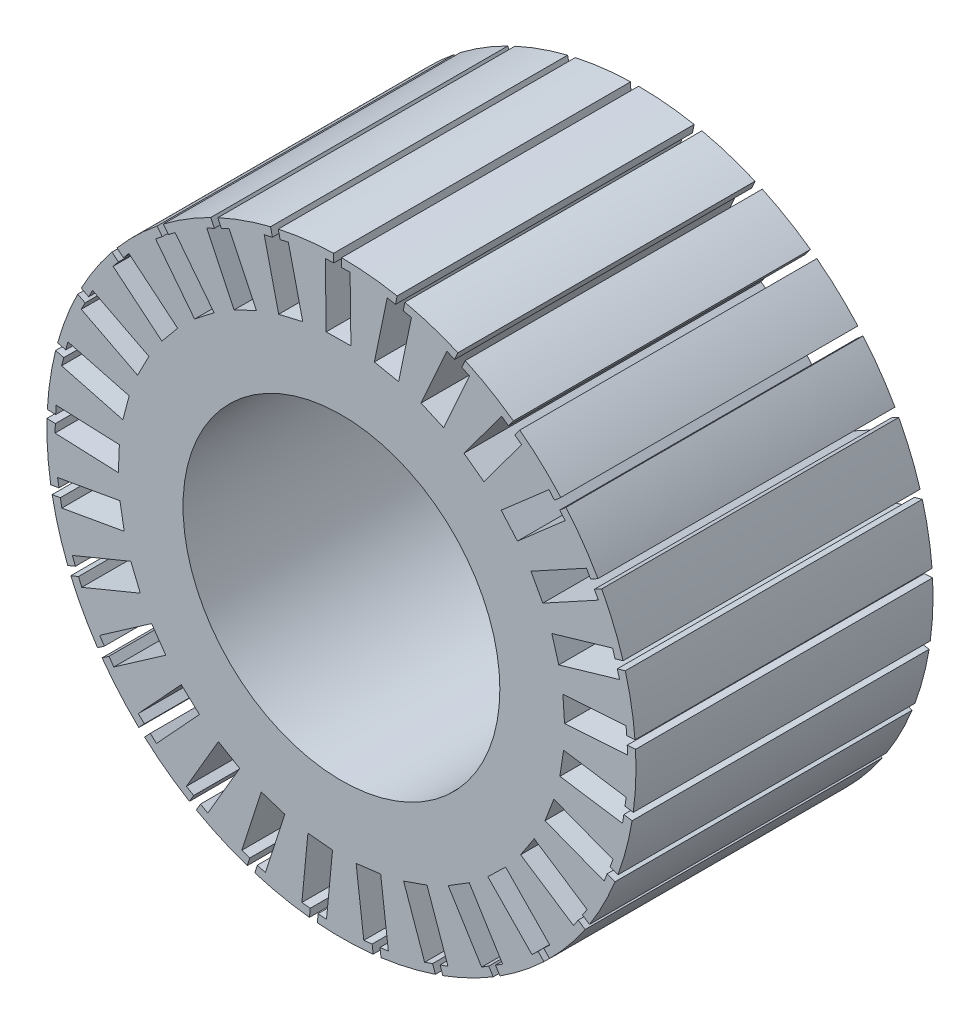
from build123d import *

# Parameters (mm, degrees)
ROTOR_STACK_START = -15
SKETCH_1_R        = 29.75
SKETCH_1_R_2      = 16
ROTOR_STACK_DEPTH = 30
ROTOR_SLOTS_DEPTH = 16


with BuildPart() as part:
    # Эскиз1 → Rotor_stack (new body)
    with BuildSketch(Plane.XY.offset(ROTOR_STACK_START)):
        Circle(SKETCH_1_R)
        Circle(SKETCH_1_R_2, mode=Mode.SUBTRACT)
    extrude(amount=ROTOR_STACK_DEPTH)

    # Эскиз2 → Rotor_slots (cut, symmetric)
    with BuildSketch(Plane.XY):
        Polygon((30.70491713, 1.664501137), (28.861684244, 1.540513747), (28.918731651, 0.692430264), (22.533161901, 0.262896843), (22.365375408, 2.757260027), (28.750945159, 3.186793448), (28.807992566, 2.338709965), (30.651225452, 2.462697356), align=None)
        Polygon((29.629234689, 8.226235577), (27.855749187, 7.708906358), (28.093775737, 6.892914103), (21.949834048, 5.100714194), (21.249755958, 7.500691416), (27.393697648, 9.292891325), (27.631724198, 8.47689907), (29.4052097, 8.994228289), align=None)
        Polygon((27.168122163, 14.403320385), (25.547310257, 13.516839077), (25.955186093, 12.771092939), (20.34015635, 9.700027818), (19.140521537, 11.893398812), (24.755551281, 14.964463933), (25.163427117, 14.218717795), (26.784239023, 15.105199103), align=None)
        Polygon((23.436658441, 19.90692194), (22.044307494, 18.692739423), (22.602960795, 18.052109663), (17.779395547, 13.845778923), (16.136297602, 15.729984098), (20.959862849, 19.936314838), (21.518516151, 19.295685079), (22.910867099, 20.509867596), align=None)
        Polygon((18.609322618, 24.479697949), (17.510537412, 22.994588049), (18.193846171, 22.489029803), (14.387289969, 17.344116793), (12.377558325, 18.83105281), (16.184114527, 23.97596582), (16.867423286, 23.470407574), (17.966208492, 24.955517475), align=None)
        Polygon((12.911835552, 27.90783049), (12.157994063, 26.221235294), (12.934007522, 25.874387904), (10.322450703, 20.031463039), (8.040058177, 21.051602421), (10.651614996, 26.894527287), (11.427628455, 26.547679897), (12.181469944, 28.234275092), align=None)
        Polygon((6.610605407, 30.031023895), (6.236956424, 28.22180672), (7.069389055, 28.049888385), (5.774945114, 21.782160337), (3.326613846, 22.287802501), (4.621057787, 28.555530549), (5.453490418, 28.383612213), (5.827139401, 30.192829387), align=None)
        Polygon((0.000270699, 30.749999999), (0.024285634, 28.90275783), (0.874213814, 28.913807259), (0.95740951, 22.514348026), (-1.542379252, 22.481849707), (-1.625574949, 28.88130894), (-0.77564677, 28.892358368), (-0.799661705, 30.739600537), align=None)
        Polygon((-6.610076666, 30.031140279), (-6.189520724, 28.232248107), (-5.361838694, 28.425748641), (-3.904893498, 22.193789824), (-6.339252411, 21.624670607), (-7.796197607, 27.856629424), (-6.968515576, 28.050129958), (-7.389071518, 29.84902213), align=None)
        Polygon((-12.911344193, 27.908057817), (-12.113911973, 26.241629841), (-11.347177584, 26.60853361), (-8.584608027, 20.835474677), (-10.839709172, 19.756345944), (-13.602278729, 25.529404877), (-12.83554434, 25.896308646), (-13.632976559, 27.562736623), align=None)
        Polygon((-18.608891615, 24.48002559), (-17.471870162, 23.023982128), (-16.801935061, 23.547133121), (-12.862915825, 18.502915891), (-14.83331318, 16.964236502), (-18.772332416, 22.008453732), (-18.102397316, 22.531604724), (-19.239418768, 23.987648185), align=None)
        Polygon((-23.436307947, 19.907334573), (-22.01286312, 18.729758601), (-21.471052729, 19.384694857), (-16.539767975, 15.305181323), (-18.13332795, 13.378898216), (-23.064612703, 17.45841175), (-22.522802312, 18.113348007), (-23.946247139, 19.290923979), align=None)
        Polygon((-27.167868568, 14.403798717), (-25.524559065, 13.559752378), (-25.136207835, 14.315849807), (-19.443238958, 11.391793486), (-20.585448458, 9.167977519), (-26.278417335, 12.092033839), (-25.890066105, 12.848131268), (-27.533375608, 13.692177607), align=None)
        Polygon((-29.629089849, 8.226757242), (-27.842754996, 7.755707204), (-27.626021799, 8.57761153), (-21.437565696, 6.945738047), (-22.075016276, 4.528372382), (-28.263472378, 6.160245865), (-28.046739181, 6.982150191), (-29.833074035, 7.453200229), align=None)
        Polygon((-30.704887819, 1.665041741), (-28.859054648, 1.589013781), (-28.824073688, 2.438293672), (-22.429495689, 2.174907617), (-22.532380867, -0.322974414), (-28.926958866, -0.059588359), (-28.891977905, 0.789691532), (-30.737811076, 0.865719491), align=None)
        Polygon((-30.344959361, -4.974529261), (-28.52593698, -4.65198016), (-28.674343927, -3.815036088), (-22.372647392, -2.697619077), (-21.936156372, -5.159219286), (-28.237852907, -6.276636298), (-28.386259854, -5.439692226), (-30.205282235, -5.762241328), align=None)
        Polygon((-28.566134329, -11.381496803), (-26.858978203, -10.675452679), (-27.183833713, -9.889979002), (-21.269678968, -7.4440081), (-20.314221585, -9.754224798), (-26.22837633, -12.200195699), (-26.55323184, -11.414722022), (-28.260387967, -12.120766146), align=None)
        Polygon((-25.451588605, -17.256278205), (-23.936123457, -16.199752895), (-24.422237648, -15.502477488), (-19.172163995, -11.842323579), (-17.742416374, -13.893133599), (-22.992490027, -17.553287509), (-23.478604218, -16.856012102), (-24.994069366, -17.912537411), align=None)
        Polygon((-21.146954885, -22.324175216), (-19.89404218, -20.966570671), (-20.518684893, -20.390097358), (-16.178179942, -15.686905168), (-14.340995493, -17.382414915), (-18.681500444, -22.085607104), (-19.306143157, -21.50913379), (-20.559055862, -22.866738335), align=None)
        Polygon((-15.853513058, -26.348218606), (-14.921737603, -24.753014906), (-15.655701238, -24.324298936), (-12.427722176, -18.797984507), (-10.269005602, -20.058913828), (-13.496984664, -25.585228257), (-14.230948299, -25.156512288), (-15.162723754, -26.751715989), align=None)
        Polygon((-9.81877858, -29.140248578), (-9.251709159, -27.382035674), (-10.060674393, -27.121123332), (-8.096157933, -21.030090982), (-5.716848422, -21.797480224), (-7.681364881, -27.888512573), (-8.490330115, -27.627600231), (-9.057399537, -29.385813136), align=None)
        Polygon((-3.324928929, -30.569712914), (-3.149081077, -28.730702887), (-3.995221595, -28.649794143), (-3.386026344, -22.278853777), (-0.897377763, -22.516820671), (-1.506573014, -28.887761037), (-2.352713532, -28.806852293), (-2.528561383, -30.64586232), align=None)
        Polygon((3.324390704, -30.569771449), (3.100794535, -28.735954365), (2.257043325, -28.838832421), (1.482432074, -22.48588213), (3.964053282, -22.18329961), (4.738664533, -28.536249902), (3.894913322, -28.639127958), (4.118509491, -30.472945043), align=None)
        Polygon((9.818265522, -29.140421447), (9.205680442, -27.397544554), (8.403771407, -27.679398948), (6.281573616, -21.641495625), (8.640129601, -20.812512113), (10.762327392, -26.850415436), (9.960418357, -27.13226983), (10.573003438, -28.875146724), align=None)
        Polygon((15.853049157, -26.348497726), (14.880118962, -24.778056011), (14.157548478, -25.225707544), (10.786995757, -19.785176839), (12.912203064, -18.468554682), (16.282755785, -23.909085387), (15.560185301, -24.35673692), (16.533115495, -25.927178636), align=None)
        Polygon((21.146561833, -22.324547535), (19.858779658, -20.999973107), (19.249334318, -21.592490091), (14.788029965, -17.003725173), (16.580516262, -15.26102816), (21.041820614, -19.849793078), (20.432375273, -20.442310063), (21.720157447, -21.766884491), align=None)
        Polygon((25.451284779, -17.256726314), (23.908865889, -16.2399548), (23.441042678, -16.9496318), (18.097592328, -13.427198216), (19.473542947, -11.339912923), (24.816993297, -14.862346507), (24.349170087, -15.572023506), (25.891588977, -16.58879502), align=None)
        Polygon((28.565933937, -11.381999749), (26.841000123, -10.720574257), (26.536673936, -11.514227564), (20.560931388, -9.222830393), (21.456008407, -6.88855596), (27.431750956, -9.179953131), (27.127424769, -9.973606438), (28.852358583, -10.635031931), align=None)
        Polygon((30.344871773, -4.975063527), (28.518079023, -4.699911576), (28.391479815, -5.540430844), (22.062864148, -4.587213273), (22.435214761, -2.115097778), (28.763830428, -3.068315349), (28.63723122, -3.908834617), (30.464023969, -4.183986569), align=None)
    extrude(amount=ROTOR_SLOTS_DEPTH, both=True, mode=Mode.SUBTRACT)


solid = part.part
